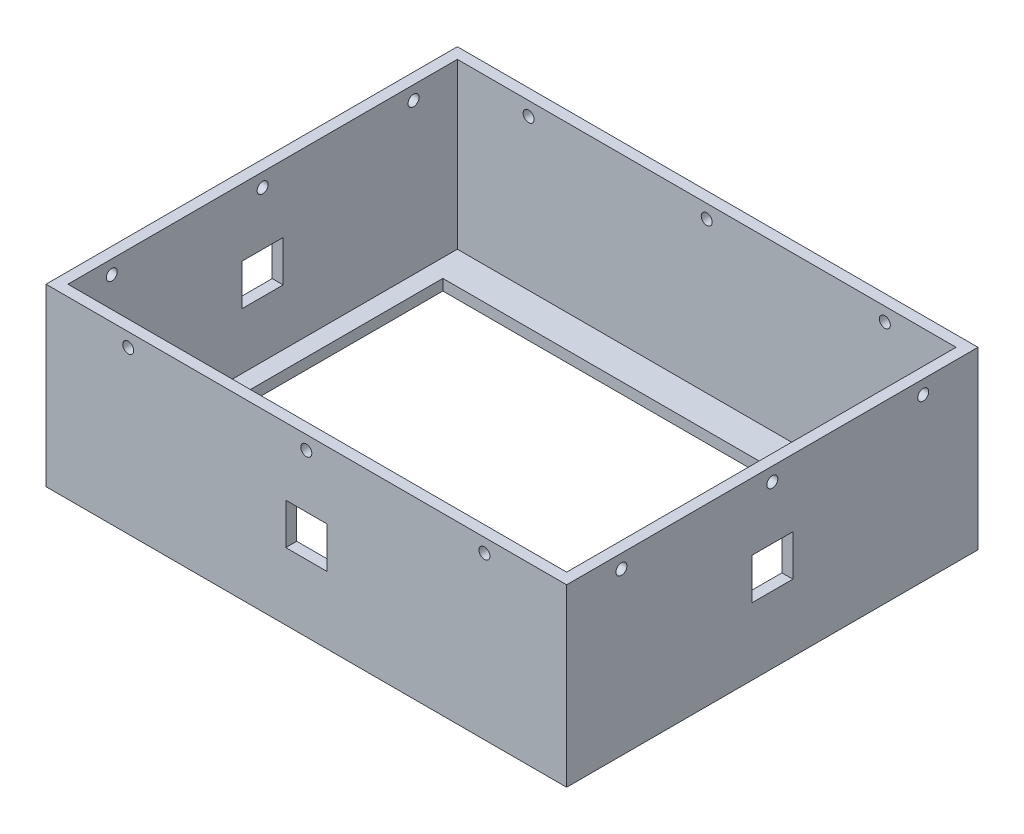
from build123d import *

# Parameters (mm, degrees)
SKETCH1_W           = 189.996176074
SKETCH1_H           = 150.112754898
BOSS_EXTRUDE1_DEPTH = 60
SKETCH2_W           = 189.996176074
SKETCH2_H           = 150.112754898
BOSS_EXTRUDE2_DEPTH = 4
SKETCH3_W           = 169.42
SKETCH3_H           = 125.25
CUT_EXTRUDE1_DEPTH  = 4
SKETCH4_W           = 15
SKETCH4_H           = 15
CUT_EXTRUDE2_DEPTH  = 222
SKETCH6_W           = 15
SKETCH6_H           = 15
CUT_EXTRUDE3_DEPTH  = 50
SKETCH7_R           = 2
CUT_EXTRUDE4_DEPTH  = 220
SKETCH8_R           = 2
CUT_EXTRUDE5_DEPTH  = 220


with BuildPart() as part:
    # Sketch1 → Boss-Extrude1 (new body)
    with BuildSketch(Plane(origin=(0, 0, 0), x_dir=(1, 0, 0), z_dir=(0, 1, 0))):
        with Locations((7, -10.5)):
            Rectangle(SKETCH1_W, SKETCH1_H)
        Polygon((97.998088037, 60.556377449), (97.998088037, -81.556377449), (-83.998088037, -81.556377449), (-83.998088037, 60.556377449), (16.315151501, 60.556377449), align=None, mode=Mode.SUBTRACT)
    extrude(amount=BOSS_EXTRUDE1_DEPTH)

    # Sketch2 → Boss-Extrude2 (add)
    with BuildSketch(Plane.XZ):
        with Locations((7, 10.5)):
            Rectangle(SKETCH2_W, SKETCH2_H)
    extrude(amount=BOSS_EXTRUDE2_DEPTH)

    # Sketch3 → Cut-Extrude1 (cut)
    with BuildSketch(Plane(origin=(0, 0, 0), x_dir=(1, 0, 0), z_dir=(0, 1, 0))):
        with Locations((7.288088037, -13.931377449)):
            Rectangle(SKETCH3_W, SKETCH3_H)
    extrude(amount=-CUT_EXTRUDE1_DEPTH, mode=Mode.SUBTRACT)

    # Sketch4 → Cut-Extrude2 (cut)
    with BuildSketch(Plane.ZY.offset(87.998088037)):
        with Locations((10.498622551, 28)):
            Rectangle(SKETCH4_W, SKETCH4_H)
    extrude(amount=-CUT_EXTRUDE2_DEPTH, mode=Mode.SUBTRACT)

    # Sketch6 → Cut-Extrude3 (cut)
    with BuildSketch(Plane.XY.offset(85.556377449)):
        with Locations((7.001911963, 28)):
            Rectangle(SKETCH6_W, SKETCH6_H)
    extrude(amount=-CUT_EXTRUDE3_DEPTH, mode=Mode.SUBTRACT)

    # Sketch7 → Cut-Extrude4 (cut)
    with BuildSketch(Plane(origin=(101.998088037, 0, 0), x_dir=(0, 0, -1), z_dir=(1, 0, 0))):
        with Locations((-65.556377449, 55)):
            Circle(SKETCH7_R)
        with Locations((-10.501377449, 55)):
            Circle(SKETCH7_R)
        with Locations((44.556377449, 55)):
            Circle(SKETCH7_R)
    extrude(amount=-CUT_EXTRUDE4_DEPTH, mode=Mode.SUBTRACT)

    # Sketch8 → Cut-Extrude5 (cut)
    with BuildSketch(Plane(origin=(0, 0, -64.556377449), x_dir=(-1, 0, 0), z_dir=(0, 0, -1))):
        with Locations((-71.998088037, 55)):
            Circle(SKETCH8_R)
        with Locations((-6.998088037, 55)):
            Circle(SKETCH8_R)
        with Locations((57.998088037, 55)):
            Circle(SKETCH8_R)
    extrude(amount=-CUT_EXTRUDE5_DEPTH, mode=Mode.SUBTRACT)


solid = part.part
